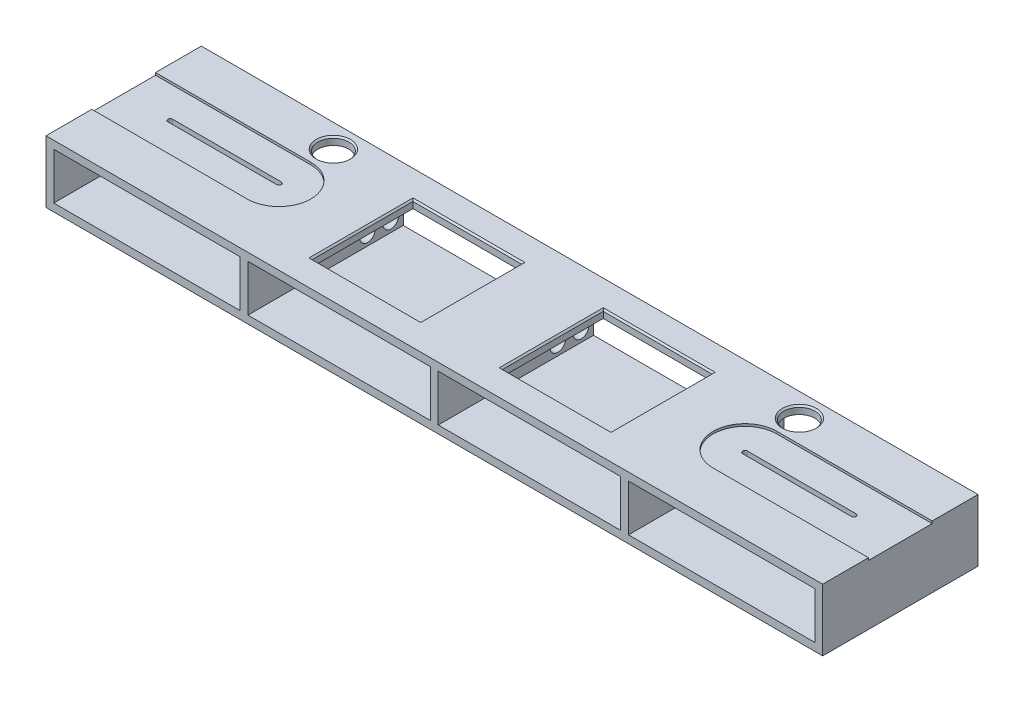
from build123d import *

# Parameters (mm, degrees)
CROQUIS1_W              = 500
CROQUIS1_H              = 100
SALIENTE_EXTRUIR1_DEPTH = 40
VACIADO1_T              = -5
CROQUIS2_W              = 2.5
CROQUIS2_H              = 30
SALIENTE_EXTRUIR2_DEPTH = 100
CORTAR_EXTRUIR1_DEPTH   = 1.5
CORTAR_EXTRUIR2_DEPTH   = 5
CROQUIS5_R              = 10
CORTAR_EXTRUIR3_DEPTH   = 22.5
CROQUIS6_R              = 5
CORTAR_EXTRUIR4_DEPTH   = 281.5
CROQUIS7_W              = 70
CROQUIS7_H              = 65
CORTAR_EXTRUIR5_DEPTH   = 5
CHAFL_N1_SIZE           = 1
CHAFL_N2_SIZE           = 1


with BuildPart() as part:
    # Croquis1 → Saliente-Extruir1 (new body)
    with BuildSketch(Plane(origin=(0, 0, 0), x_dir=(1, 0, 0), z_dir=(0, 1, 0))):
        Rectangle(CROQUIS1_W, CROQUIS1_H)
    extrude(amount=SALIENTE_EXTRUIR1_DEPTH)

    # Vaciado1
    vaciado1_openings = [part.faces().sort_by_distance(p)[0] for p in [
        (0, 20, -50),
        (0, 20, 50),
    ]]
    offset(amount=VACIADO1_T, openings=vaciado1_openings, kind=Kind.INTERSECTION)

    # Croquis2 → Saliente-Extruir2 (add)
    with BuildSketch(Plane.XY.offset(50)):
        with Locations((-123.75, 20)):
            Rectangle(CROQUIS2_W, CROQUIS2_H)
        with Locations((-121.25, 20)):
            Rectangle(CROQUIS2_W, CROQUIS2_H)
        with Locations((-1.25, 20)):
            Rectangle(CROQUIS2_W, CROQUIS2_H)
        with Locations((1.25, 20)):
            Rectangle(CROQUIS2_W, CROQUIS2_H)
        with Locations((121.25, 20)):
            Rectangle(CROQUIS2_W, CROQUIS2_H)
        with Locations((123.75, 20)):
            Rectangle(CROQUIS2_W, CROQUIS2_H)
    extrude(amount=-SALIENTE_EXTRUIR2_DEPTH)

    # Croquis3 → Cortar-Extruir1 (cut)
    with BuildSketch(Plane(origin=(0, 40, 0), x_dir=(1, 0, 0), z_dir=(0, 1, 0))):
        with BuildLine():
            Line((-250, 20.5), (-150, 20.5))
            ThreePointArc((-150, 20.5), (-129.5, 0), (-150, -20.5))
            Line((-150, -20.5), (-250, -20.5))
            Line((-250, -20.5), (-250, 20.5))
        make_face()
        with BuildLine():
            Line((250, 20.5), (150, 20.5))
            ThreePointArc((150, 20.5), (129.5, 0), (150, -20.5))
            Line((150, -20.5), (250, -20.5))
            Line((250, -20.5), (250, 20.5))
        make_face()
    extrude(amount=-CORTAR_EXTRUIR1_DEPTH, mode=Mode.SUBTRACT)

    # Croquis4 → Cortar-Extruir2 (cut)
    with BuildSketch(Plane(origin=(0, 38.5, 0), x_dir=(1, 0, 0), z_dir=(0, 1, 0))):
        with BuildLine():
            Line((-150, -1.5), (-220, -1.5))
            ThreePointArc((-220, -1.5), (-221.5, 0), (-220, 1.5))
            Line((-220, 1.5), (-150, 1.5))
            ThreePointArc((-150, 1.5), (-148.5, 0), (-150, -1.5))
        make_face()
        with BuildLine():
            Line((150, 1.5), (220, 1.5))
            ThreePointArc((220, 1.5), (221.5, 0), (220, -1.5))
            Line((220, -1.5), (150, -1.5))
            ThreePointArc((150, -1.5), (148.5, 0), (150, 1.5))
        make_face()
    extrude(amount=-CORTAR_EXTRUIR2_DEPTH, mode=Mode.SUBTRACT)

    # Croquis5 → Cortar-Extruir3 (cut)
    with BuildSketch(Plane(origin=(0, 40, 0), x_dir=(1, 0, 0), z_dir=(0, 1, 0))):
        with Locations(Location((-150, 35, 0), (0, 0, 270))):
            Circle(CROQUIS5_R)
    cortar_extruir3 = extrude(amount=-CORTAR_EXTRUIR3_DEPTH, mode=Mode.SUBTRACT)

    # Simetría1: Cortar-Extruir3 across plane
    add(cortar_extruir3.mirror(Plane(origin=(0, 0, 0), x_dir=(0, 0, 1), z_dir=(1, 0, 0))), mode=Mode.SUBTRACT)

    # Croquis6 → Cortar-Extruir4 (cut)
    with BuildSketch(Plane.ZY.offset(125)):
        with Locations((-42, 27)):
            Circle(CROQUIS6_R)
        with Locations((-27, 27)):
            Circle(CROQUIS6_R)
        with Locations((-27, 12)):
            Circle(CROQUIS6_R)
        with Locations((-42, 12)):
            Circle(CROQUIS6_R)
    extrude(amount=-CORTAR_EXTRUIR4_DEPTH, mode=Mode.SUBTRACT)

    # Croquis7 → Cortar-Extruir5 (cut)
    with BuildSketch(Plane(origin=(0, 40, 0), x_dir=(1, 0, 0), z_dir=(0, 1, 0))):
        with Locations((-61.25, 0)):
            Rectangle(CROQUIS7_W, CROQUIS7_H)
        with Locations((61.25, 0)):
            Rectangle(CROQUIS7_W, CROQUIS7_H)
    extrude(amount=-CORTAR_EXTRUIR5_DEPTH, mode=Mode.SUBTRACT)

    # Chaflán1
    chafl_n1_edges = [part.edges().sort_by_distance(p)[0] for p in [
        (-96.25, 40, 0),
        (-61.25, 40, 32.5),
        (-26.25, 40, 0),
        (-61.25, 40, -32.5),
        (61.25, 40, 32.5),
        (96.25, 40, 0),
        (61.25, 40, -32.5),
        (26.25, 40, 0),
    ]]
    chamfer(chafl_n1_edges, length=CHAFL_N1_SIZE)

    # Chaflán2
    chafl_n2_edges = [part.edges().sort_by_distance(p)[0] for p in [
        (-150, 40, -45),
        (150, 40, -45),
    ]]
    chamfer(chafl_n2_edges, length=CHAFL_N2_SIZE)


solid = part.part
